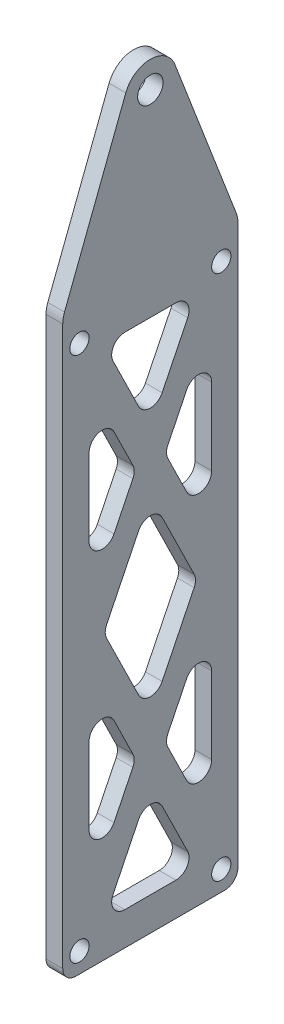
from build123d import *

# Parameters (mm, degrees)
SKETCH1_W           = 41.514809608
SKETCH1_H           = 98.81
SKETCH1_R           = 1.8288
SKETCH1_R_2         = 2.413
BOSS_EXTRUDE1_DEPTH = 3.175
CUT_EXTRUDE1_DEPTH  = 106.912542124
FILLET1_R           = 2.5
FILLET2_R           = 5


with BuildPart() as part:
    # Sketch1 → Boss-Extrude1 (new body)
    # profile 1 of 2: a face of its own
    with BuildSketch(Plane(origin=(0, 0, 0), x_dir=(0, 0, -1), z_dir=(1, 0, 0))):
        with Locations((0, -54.405)):
            Rectangle(SKETCH1_W, SKETCH1_H)
        with Locations((13.4747, -100)):
            Circle(SKETCH1_R, mode=Mode.SUBTRACT)
        with Locations((-13.4747, -100)):
            Circle(SKETCH1_R, mode=Mode.SUBTRACT)
    # profile 2 of 2: a face of its own
    with BuildSketch(Plane(origin=(0, 0, 0), x_dir=(0, 0, -1), z_dir=(1, 0, 0))):
        Polygon((0, 48.916537522), (20.757404804, -5), (-20.757404804, -5), align=None)
        with Locations((13.4747, 0)):
            Circle(SKETCH1_R, mode=Mode.SUBTRACT)
        with Locations((0, 35)):
            Circle(SKETCH1_R_2, mode=Mode.SUBTRACT)
        with Locations((-13.4747, 0)):
            Circle(SKETCH1_R, mode=Mode.SUBTRACT)
    extrude(amount=BOSS_EXTRUDE1_DEPTH)

    # Sketch2 → Cut-Extrude1 (cut, through all)
    with BuildSketch(Plane(origin=(3.175, 0, 0), x_dir=(0, 0, -1), z_dir=(1, 0, 0))):
        Polygon((16.645, 5.681808734), (16.645, -103.81), (20.757404804, -103.81), (20.757404804, -5), align=None)
        Polygon((-20.757404804, -103.81), (-16.645, -103.81), (-16.645, 5.681808734), (-20.757404804, -5), align=None)
        Polygon((-11.645, -91.821329309), (-2.784341903, -73.75), (-11.645, -55.678670691), align=None)
        Polygon((8.860658097, -97.5), (0, -79.428670691), (-8.860658097, -97.5), align=None)
        Polygon((2.784341903, -73.75), (11.645, -91.821329309), (11.645, -55.678670691), align=None)
        Polygon((-8.860658097, -50), (0, -68.071329309), (8.860658097, -50), (0, -31.928670691), align=None)
        Polygon((11.645, -8.178670691), (2.784341903, -26.25), (11.645, -44.321329309), align=None)
        Polygon((-11.645, -44.321329309), (-2.784341903, -26.25), (-11.645, -8.178670691), align=None)
        Polygon((-8.860658097, -2.5), (0, -20.571329309), (8.860658097, -2.5), align=None)
    extrude(amount=-CUT_EXTRUDE1_DEPTH, mode=Mode.SUBTRACT)

    # Fillet1
    fillet1_edges = [part.edges().sort_by_distance(p)[0] for p in [
        (1.5875, -91.821329309, -11.645),
        (1.5875, -73.75, -2.784341903),
        (1.5875, -55.678670691, -11.645),
        (1.5875, -97.5, 8.860658097),
        (1.5875, -79.428670691, 0),
        (1.5875, -97.5, -8.860658097),
        (1.5875, -103.81, -16.645),
        (1.5875, -44.321329309, -11.645),
        (1.5875, -26.25, -2.784341903),
        (1.5875, -8.178670691, -11.645),
        (1.5875, -50, -8.860658097),
        (1.5875, -68.071329309, 0),
        (1.5875, -50, 8.860658097),
        (1.5875, -31.928670691, 0),
        (1.5875, -2.5, -8.860658097),
        (1.5875, -20.571329309, 0),
        (1.5875, -2.5, 8.860658097),
        (1.5875, -8.178670691, 11.645),
        (1.5875, -26.25, 2.784341903),
        (1.5875, -44.321329309, 11.645),
        (1.5875, -103.81, 16.645),
        (1.5875, -55.678670691, 11.645),
        (1.5875, -73.75, 2.784341903),
        (1.5875, -91.821329309, 11.645),
    ]]
    fillet(fillet1_edges, radius=FILLET1_R)

    # Fillet2
    fillet2_edges = [part.edges().sort_by_distance(p)[0] for p in [
        (1.5875, 48.916537522, 0),
        (1.5875, 5.681808734, -16.645),
        (1.5875, 5.681808734, 16.645),
    ]]
    fillet(fillet2_edges, radius=FILLET2_R)


solid = part.part
